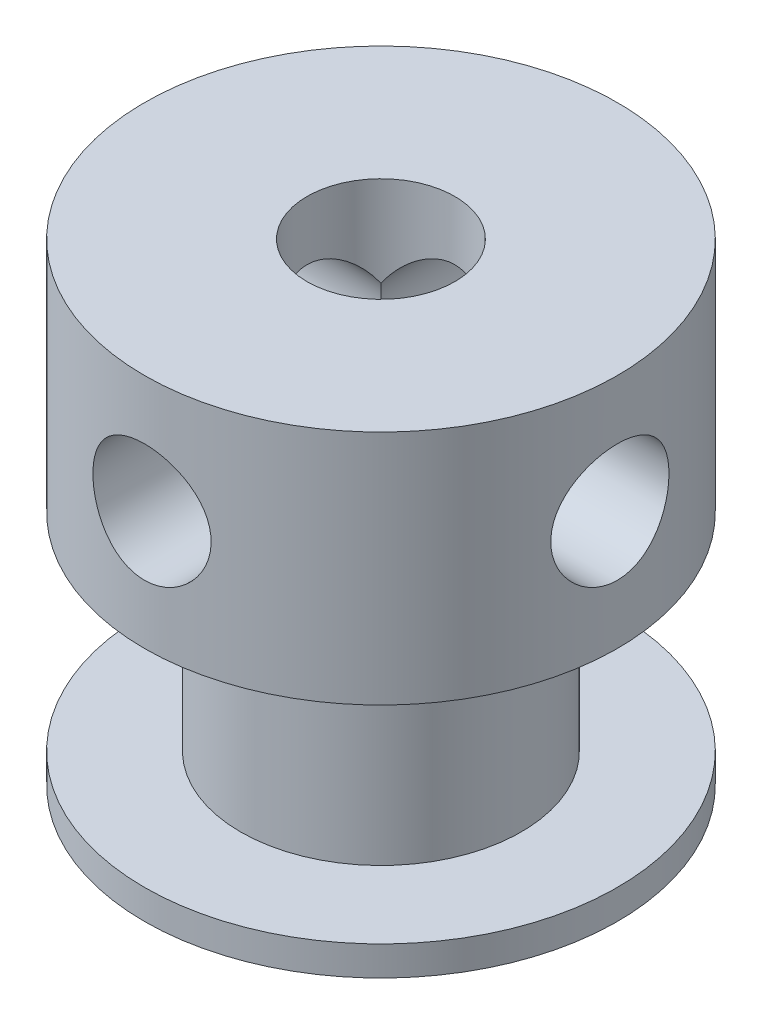
from build123d import *

# Parameters (mm, degrees)
SKETCH2_W         = 2
SKETCH2_H         = 8
CIRPATTERN1_COUNT = 4


with BuildPart() as part:
    # Sketch1 → Revolve1 (revolve)
    with BuildSketch(Plane.XY, mode=Mode.PRIVATE) as revolve1_sk:
        Polygon((-2.5, 0), (-8, 0), (-8, 1), (-4.75, 1), (-4.75, 8), (-8, 8), (-8, 16), (-2.5, 16), align=None)
    revolve(revolve1_sk.sketch.rotate(Axis((0, 17.601415094, 0), (0, -1, 0)), 270), axis=Axis((0, 17.601415094, 0), (0, -1, 0)))

    # Sketch2 → Ø4.0 (4) Diameter Hole1 (revolve, cut)
    with BuildSketch(Plane(origin=(0, 12, 0), x_dir=(0, -1, 0), z_dir=(1, 0, 0))):
        with Locations((1, 4)):
            Rectangle(SKETCH2_W, SKETCH2_H)
    f_4_0_4_diameter_hole1 = revolve(axis=Axis((0, 12, 6.35), (0, 0, -1)), mode=Mode.SUBTRACT)

    # CirPattern1: Ø4.0 (4) Diameter Hole1 ×4 about axis
    cirpattern1_axis = Axis((0, 0, 0), (0, 1, 0))
    for i in range(1, CIRPATTERN1_COUNT):
        add(f_4_0_4_diameter_hole1.rotate(cirpattern1_axis, i * 360 / CIRPATTERN1_COUNT), mode=Mode.SUBTRACT)


solid = part.part
